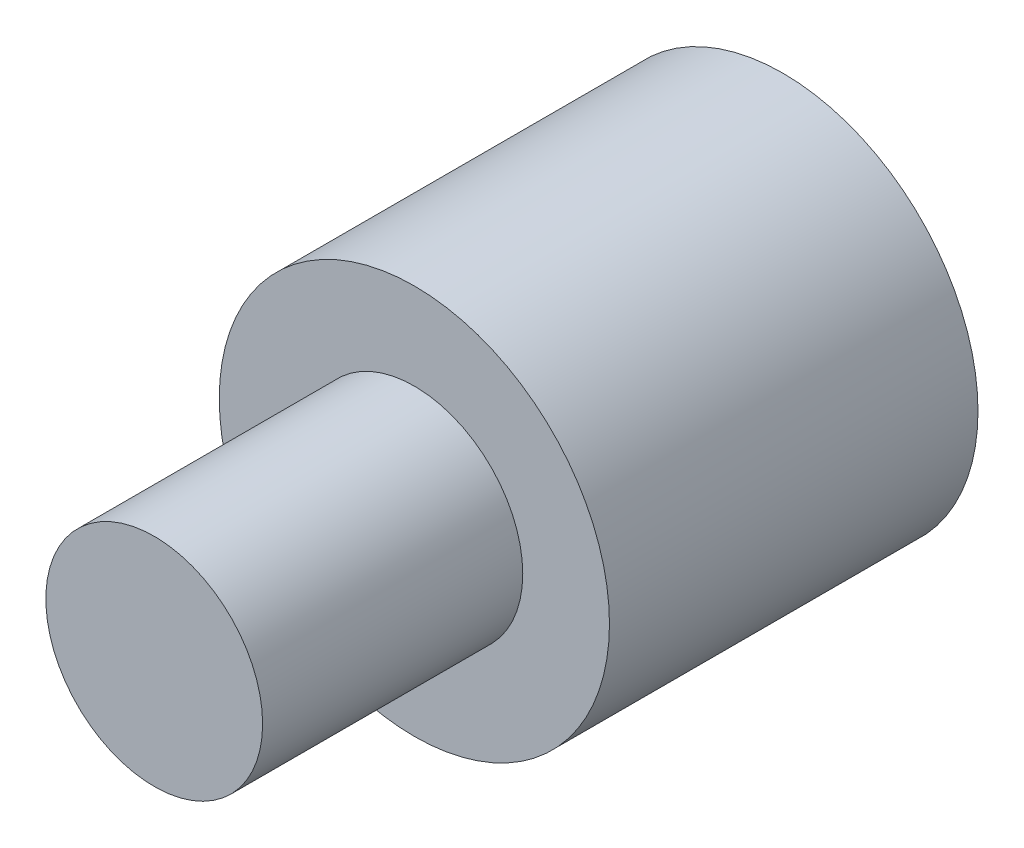
from build123d import *

# Parameters (mm, degrees)
CROQUIS1_R              = 9
SALIENTE_EXTRUIR1_DEPTH = 17
CROQUIS2_R              = 5
SALIENTE_EXTRUIR2_DEPTH = 12


with BuildPart() as part:
    # Croquis1 → Saliente-Extruir1 (new body)
    with BuildSketch(Plane.XY):
        Circle(CROQUIS1_R)
    extrude(amount=SALIENTE_EXTRUIR1_DEPTH)

    # Croquis2 → Saliente-Extruir2 (add)
    with BuildSketch(Plane.XY.offset(17)):
        Circle(CROQUIS2_R)
    extrude(amount=SALIENTE_EXTRUIR2_DEPTH)


solid = part.part
